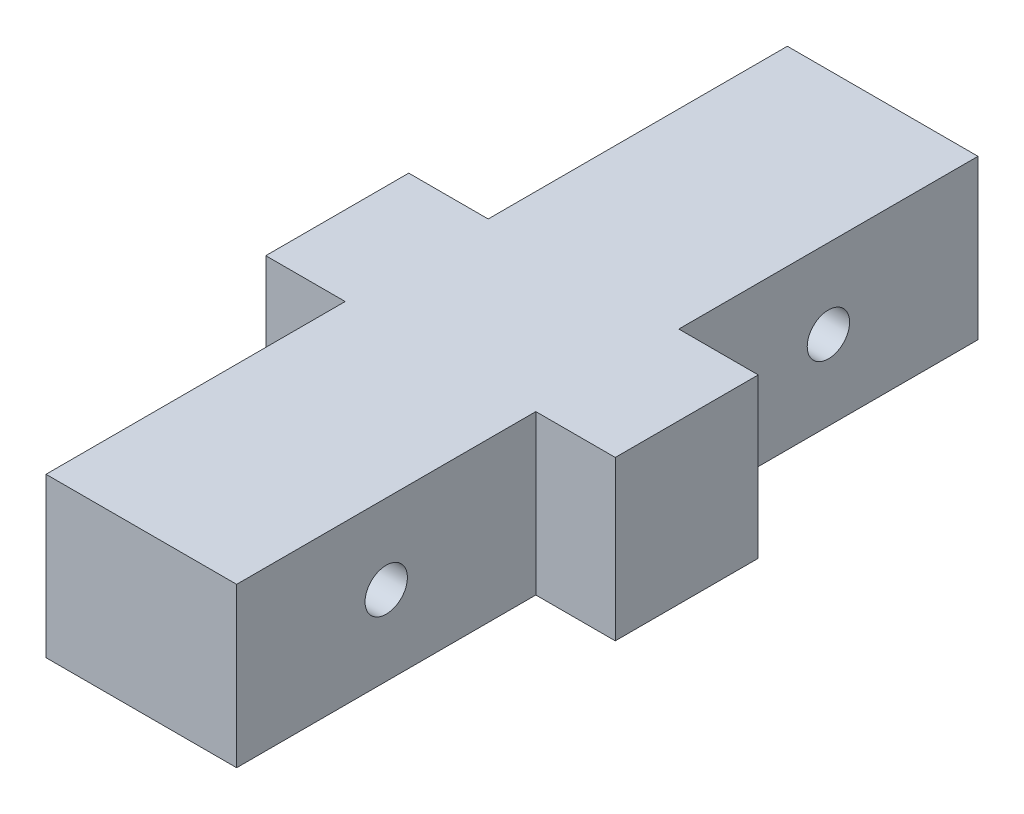
from build123d import *

# Parameters (mm, degrees)
BOSS_EXTRUDE1_DEPTH     = 60
CUT_EXTRUDE1_DEPTH      = 184.313938368
CUT_EXTRUDE1_DEPTH_BACK = 184.313938368
SKETCH2_R               = 8


with BuildPart() as part:
    # Sketch1 → Boss-Extrude1 (new body)
    with BuildSketch(Plane(origin=(0, 0, 0), x_dir=(1, 0, 0), z_dir=(0, 1, 0))):
        Polygon((-66, 27), (-36, 27), (-36, 140), (36, 140), (36, 27), (66, 27), (66, -27), (36, -27), (36, -140), (-36, -140), (-36, -27), (-66, -27), align=None)
    extrude(amount=BOSS_EXTRUDE1_DEPTH)

    # Sketch2 → Cut-Extrude1 (cut, two sides: drawn at the far end of the back side and taken through both)
    with BuildSketch(Plane.ZY.offset(36).offset(-CUT_EXTRUDE1_DEPTH_BACK)):
        with Locations((83.5, 30)):
            Circle(SKETCH2_R)
        with Locations((-83.5, 30)):
            Circle(SKETCH2_R)
    extrude(amount=CUT_EXTRUDE1_DEPTH + CUT_EXTRUDE1_DEPTH_BACK, mode=Mode.SUBTRACT)


solid = part.part
